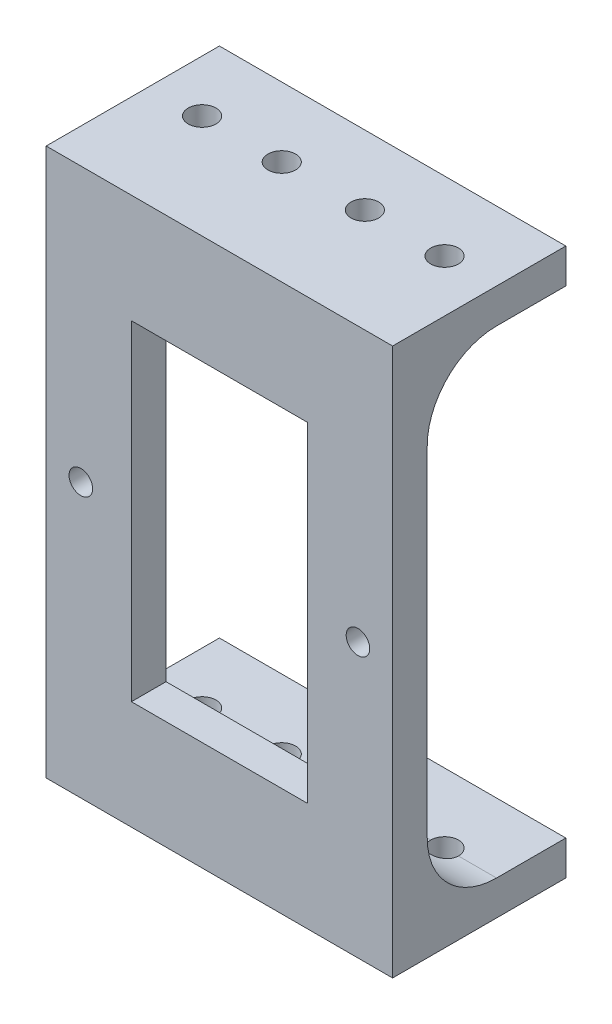
from build123d import *

# Parameters (mm, degrees)
SKETCH1_W               = 50
SKETCH1_H               = 79
SKETCH1_R               = 1.7
SKETCH1_W_2             = 25.4
SKETCH1_H_2             = 47.625
BOSS_EXTRUDE1_DEPTH     = 5
SKETCH2_W               = 20
SKETCH2_H               = 5
BOSS_EXTRUDE2_DEPTH     = 50
FILLET1_R               = 10
CUT_EXTRUDE1_DEPTH      = 86.240835285
CUT_EXTRUDE1_DEPTH_BACK = 86.240835285
SKETCH3_R               = 2


with BuildPart() as part:
    # Sketch1 → Boss-Extrude1 (new body)
    with BuildSketch(Plane.XY):
        Rectangle(SKETCH1_W, SKETCH1_H)
        with Locations((-20, 0)):
            Circle(SKETCH1_R, mode=Mode.SUBTRACT)
        with Locations((20, 0)):
            Circle(SKETCH1_R, mode=Mode.SUBTRACT)
        Rectangle(SKETCH1_W_2, SKETCH1_H_2, mode=Mode.SUBTRACT)
    extrude(amount=BOSS_EXTRUDE1_DEPTH)

    # Sketch2 → Boss-Extrude2 (add)
    with BuildSketch(Plane.ZY.offset(25)):
        with Locations((-10, 37)):
            Rectangle(SKETCH2_W, SKETCH2_H)
        with Locations((-10, -37)):
            Rectangle(SKETCH2_W, SKETCH2_H)
    extrude(amount=-BOSS_EXTRUDE2_DEPTH)

    # Fillet1
    fillet1_edges = [part.edges().sort_by_distance(p)[0] for p in [
        (0, 34.5, 0),
        (0, -34.5, 0),
    ]]
    fillet(fillet1_edges, radius=FILLET1_R)

    # Sketch3 → Cut-Extrude1 (cut, two sides: drawn at the far end of the back side and taken through both)
    with BuildSketch(Plane(origin=(0, 39.5, 0), x_dir=(1, 0, 0), z_dir=(0, 1, 0)).offset(-CUT_EXTRUDE1_DEPTH_BACK)):
        with Locations((-17.5, 10)):
            Circle(SKETCH3_R)
        with Locations((-6, 10)):
            Circle(SKETCH3_R)
        with Locations(Location((6, 10, 0), (0, 0, 180))):
            Circle(SKETCH3_R)
        with Locations((17.5, 10)):
            Circle(SKETCH3_R)
    extrude(amount=CUT_EXTRUDE1_DEPTH + CUT_EXTRUDE1_DEPTH_BACK, mode=Mode.SUBTRACT)


solid = part.part
